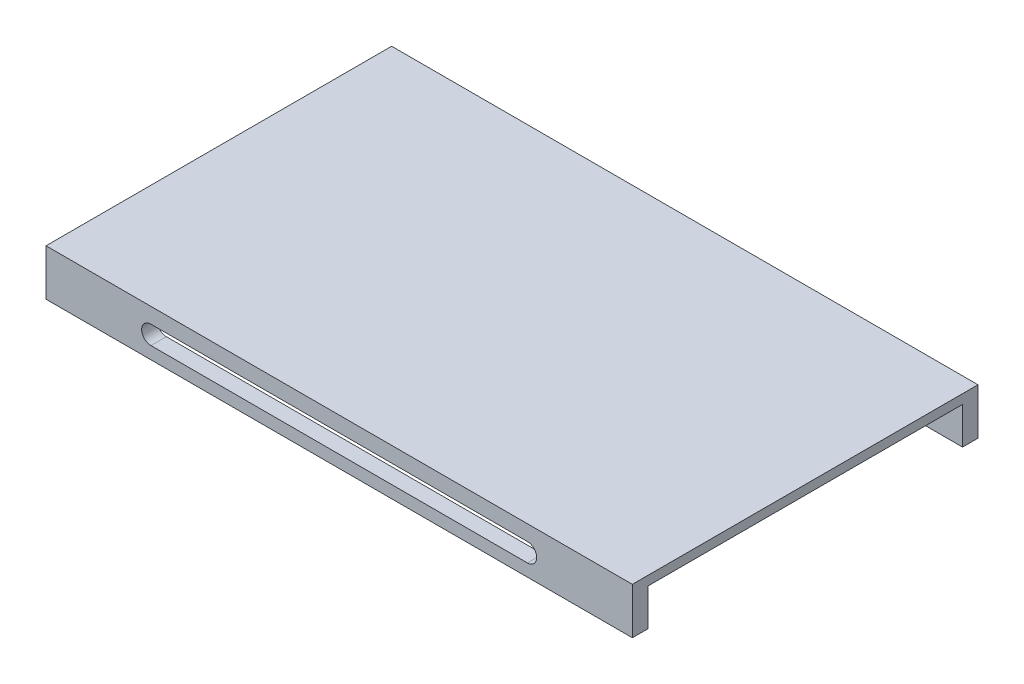
from build123d import *

# Parameters (mm, degrees)
SKETCH1_W           = 190
SKETCH1_H           = 112
BOSS_EXTRUDE1_DEPTH = 15
SKETCH5_W           = 102
SKETCH5_H           = 12
CUT_EXTRUDE3_DEPTH  = 222.06333934
CUT_EXTRUDE4_DEPTH  = 10
SKETCH6_R           = 3
CUT_EXTRUDE5_DEPTH  = 10


with BuildPart() as part:
    # Sketch1 → Boss-Extrude1 (new body)
    with BuildSketch(Plane(origin=(0, 0, 0), x_dir=(1, 0, 0), z_dir=(0, 1, 0))):
        with Locations((95, -56)):
            Rectangle(SKETCH1_W, SKETCH1_H)
    extrude(amount=BOSS_EXTRUDE1_DEPTH)

    # Sketch5 → Cut-Extrude3 (cut, through all)
    with BuildSketch(Plane(origin=(190, 0, 0), x_dir=(0, 0, -1), z_dir=(1, 0, 0))):
        with Locations((-56, 6)):
            Rectangle(SKETCH5_W, SKETCH5_H)
    extrude(amount=-CUT_EXTRUDE3_DEPTH, mode=Mode.SUBTRACT)

    # Sketch2 → Cut-Extrude4 (cut)
    with BuildSketch(Plane.XY.offset(112)):
        with BuildLine():
            Line((34, 10), (156, 10))
            ThreePointArc((156, 10), (159, 7), (156, 4))
            Line((156, 4), (34, 4))
            ThreePointArc((34, 4), (31, 7), (34, 10))
        make_face()
    extrude(amount=-CUT_EXTRUDE4_DEPTH, mode=Mode.SUBTRACT)

    # Sketch6 → Cut-Extrude5 (cut)
    with BuildSketch(Plane(origin=(0, 0, 0), x_dir=(-1, 0, 0), z_dir=(0, 0, -1))):
        with Locations((-95, 7.5)):
            Circle(SKETCH6_R)
    extrude(amount=-CUT_EXTRUDE5_DEPTH, mode=Mode.SUBTRACT)


solid = part.part
